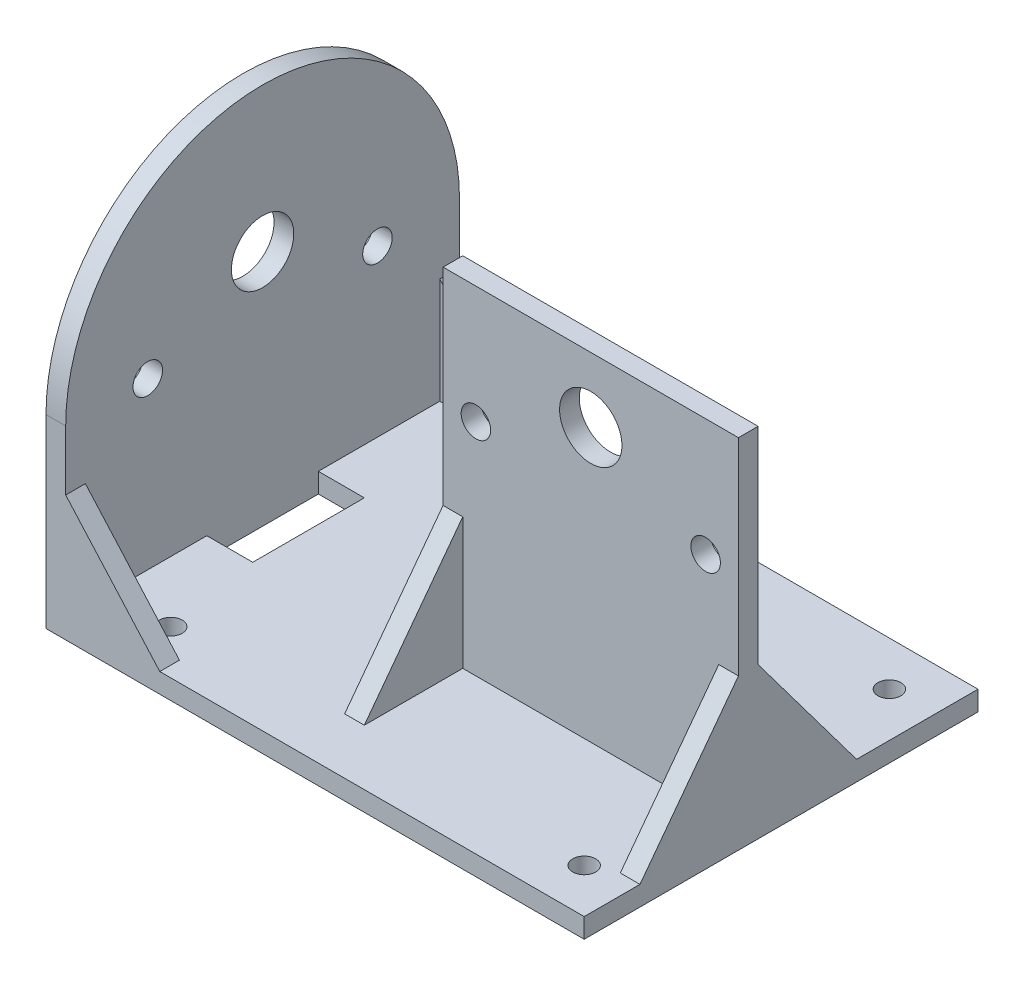
from build123d import *

# Parameters (mm, degrees)
SKETCH1_W           = 82
SKETCH1_H           = 60
BOSS_EXTRUDE1_DEPTH = 3
BOSS_EXTRUDE2_DEPTH = 3
SKETCH3_R           = 2.25
SKETCH3_R_2         = 4.75
BOSS_EXTRUDE3_DEPTH = 3
SKETCH4_W           = 7
SKETCH4_H           = 17
CUT_EXTRUDE1_DEPTH  = 3
BOSS_EXTRUDE4_START = -23.5
SKETCH5_W           = 45
SKETCH5_H           = 54.441667663
BOSS_EXTRUDE4_DEPTH = 3
SKETCH6_R           = 2.25
SKETCH6_R_2         = 4.75
CUT_EXTRUDE2_DEPTH  = 3
BOSS_EXTRUDE5_DEPTH = 3
SKETCH8_R           = 1.75
CUT_EXTRUDE3_DEPTH  = 3


with BuildPart() as part:
    # Sketch1 → Boss-Extrude1 (new body)
    with BuildSketch(Plane(origin=(0, 0, 0), x_dir=(1, 0, 0), z_dir=(0, 1, 0))):
        Rectangle(SKETCH1_W, SKETCH1_H)
    extrude(amount=BOSS_EXTRUDE1_DEPTH)

    # Sketch2 → Boss-Extrude2 (add)
    with BuildSketch(Plane.XY.offset(30)):
        Polygon((-41, 0), (-41, 22.5), (-21, 0), align=None)
    boss_extrude2 = extrude(amount=-BOSS_EXTRUDE2_DEPTH)

    # Mirror1: Boss-Extrude2 across plane
    add(boss_extrude2.mirror(Plane.XY))

    # Sketch3 → Boss-Extrude3 (add)
    with BuildSketch(Plane.ZY.offset(41)):
        with BuildLine():
            Line((-30, 0), (30, 0))
            Line((30, 0), (30, 28.236891946))
            ThreePointArc((30, 28.236891946), (0, 58.236891946), (-30, 28.236891946))
            Line((-30, 28.236891946), (-30, 0))
        make_face()
        with Locations((-17.5, 28.236891946)):
            Circle(SKETCH3_R, mode=Mode.SUBTRACT)
        with Locations((17.5, 28.236891946)):
            Circle(SKETCH3_R, mode=Mode.SUBTRACT)
        with Locations((0, 36.236891946)):
            Circle(SKETCH3_R_2, mode=Mode.SUBTRACT)
    extrude(amount=-BOSS_EXTRUDE3_DEPTH)

    # Sketch4 → Cut-Extrude1 (cut)
    with BuildSketch(Plane(origin=(0, 3, 0), x_dir=(1, 0, 0), z_dir=(0, 1, 0))):
        with Locations((-34.5, 0)):
            Rectangle(SKETCH4_W, SKETCH4_H)
    extrude(amount=-CUT_EXTRUDE1_DEPTH, mode=Mode.SUBTRACT)

    # Sketch5 → Boss-Extrude4 (add)
    with BuildSketch(Plane.XY.offset(30).offset(BOSS_EXTRUDE4_START)):
        with Locations((18.5, 27.220833832)):
            Rectangle(SKETCH5_W, SKETCH5_H)
    extrude(amount=-BOSS_EXTRUDE4_DEPTH)

    # Sketch6 → Cut-Extrude2 (cut)
    with BuildSketch(Plane.XY.offset(6.5)):
        with Locations((1, 36.536359397)):
            Circle(SKETCH6_R)
        with Locations((36, 36.536359397)):
            Circle(SKETCH6_R)
        with Locations((18.5, 44.536359397)):
            Circle(SKETCH6_R_2)
    extrude(amount=-CUT_EXTRUDE2_DEPTH, mode=Mode.SUBTRACT)

    # Sketch7 → Boss-Extrude5 (add)
    with BuildSketch(Plane(origin=(41, 0, 0), x_dir=(0, 0, -1), z_dir=(1, 0, 0))):
        Polygon((-21.5, 3), (-6.5, 3), (-6.5, 23), align=None)
        Polygon((-3.5, 3), (11.5, 3), (-3.5, 23), align=None)
    boss_extrude5 = extrude(amount=-BOSS_EXTRUDE5_DEPTH)

    # Mirror2: Boss-Extrude5 across plane
    add(boss_extrude5.mirror(Plane.ZY.offset(-18.5)))

    # Sketch8 → Cut-Extrude3 (cut)
    with BuildSketch(Plane.XZ):
        with Locations(Location((-28.75, 23.25, 0), (0, 0, 270))):
            Circle(SKETCH8_R)
        with Locations(Location((34.25, 23.25, 0), (0, 0, 270))):
            Circle(SKETCH8_R)
        with Locations(Location((34.25, -23.25, 0), (0, 0, 270))):
            Circle(SKETCH8_R)
        with Locations(Location((-28.75, -23.25, 0), (0, 0, 270))):
            Circle(SKETCH8_R)
    extrude(amount=-CUT_EXTRUDE3_DEPTH, mode=Mode.SUBTRACT)


solid = part.part
